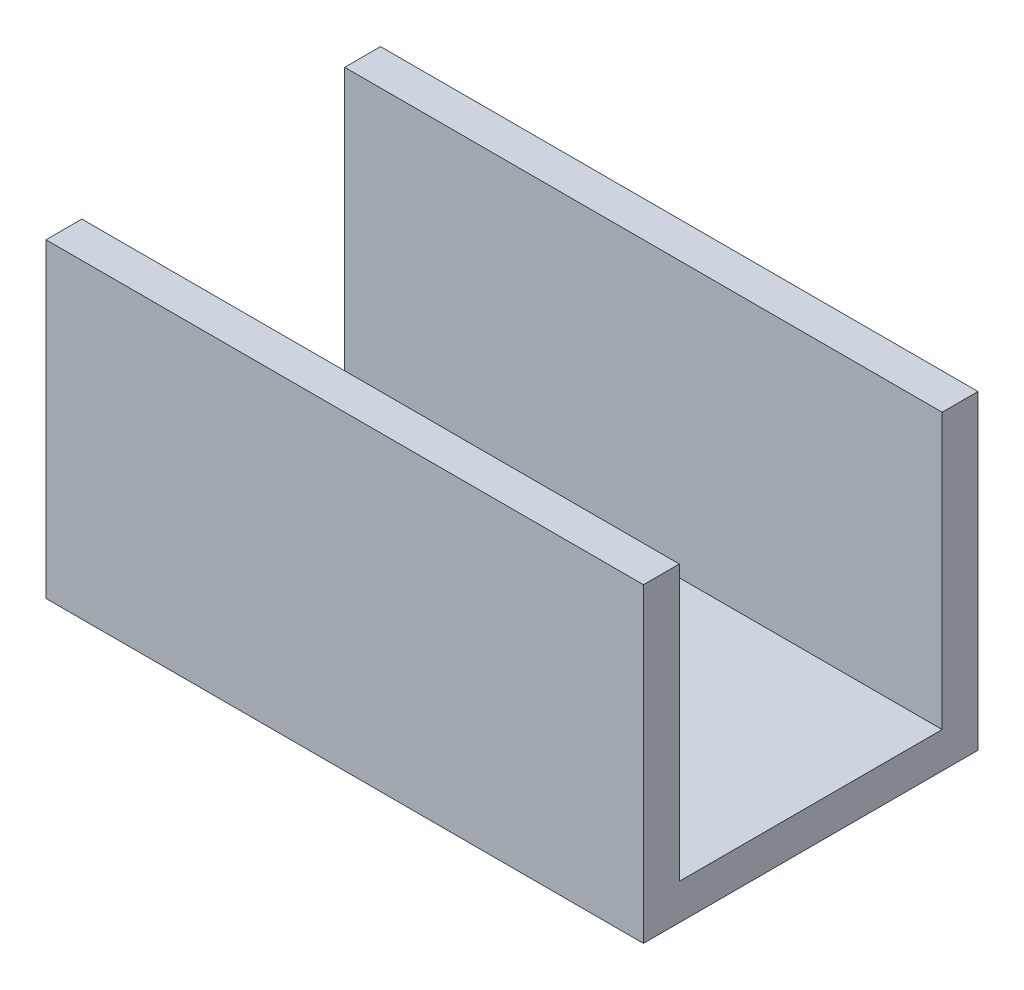
from build123d import *

# Parameters (mm, degrees)
SKETCH1_W           = 100
SKETCH1_H           = 56
BOSS_EXTRUDE1_DEPTH = 52
SKETCH4_W           = 44
SKETCH4_H           = 50
CUT_EXTRUDE2_DEPTH  = 126.85706178


with BuildPart() as part:
    # Sketch1 → Boss-Extrude1 (new body)
    with BuildSketch(Plane(origin=(0, 0, 0), x_dir=(1, 0, 0), z_dir=(0, 1, 0))):
        with Locations((50, 28)):
            Rectangle(SKETCH1_W, SKETCH1_H)
    extrude(amount=BOSS_EXTRUDE1_DEPTH)

    # Sketch4 → Cut-Extrude2 (cut, through all)
    with BuildSketch(Plane.ZY):
        with Locations((-28, 31)):
            Rectangle(SKETCH4_W, SKETCH4_H)
    extrude(amount=-CUT_EXTRUDE2_DEPTH, mode=Mode.SUBTRACT)


solid = part.part
